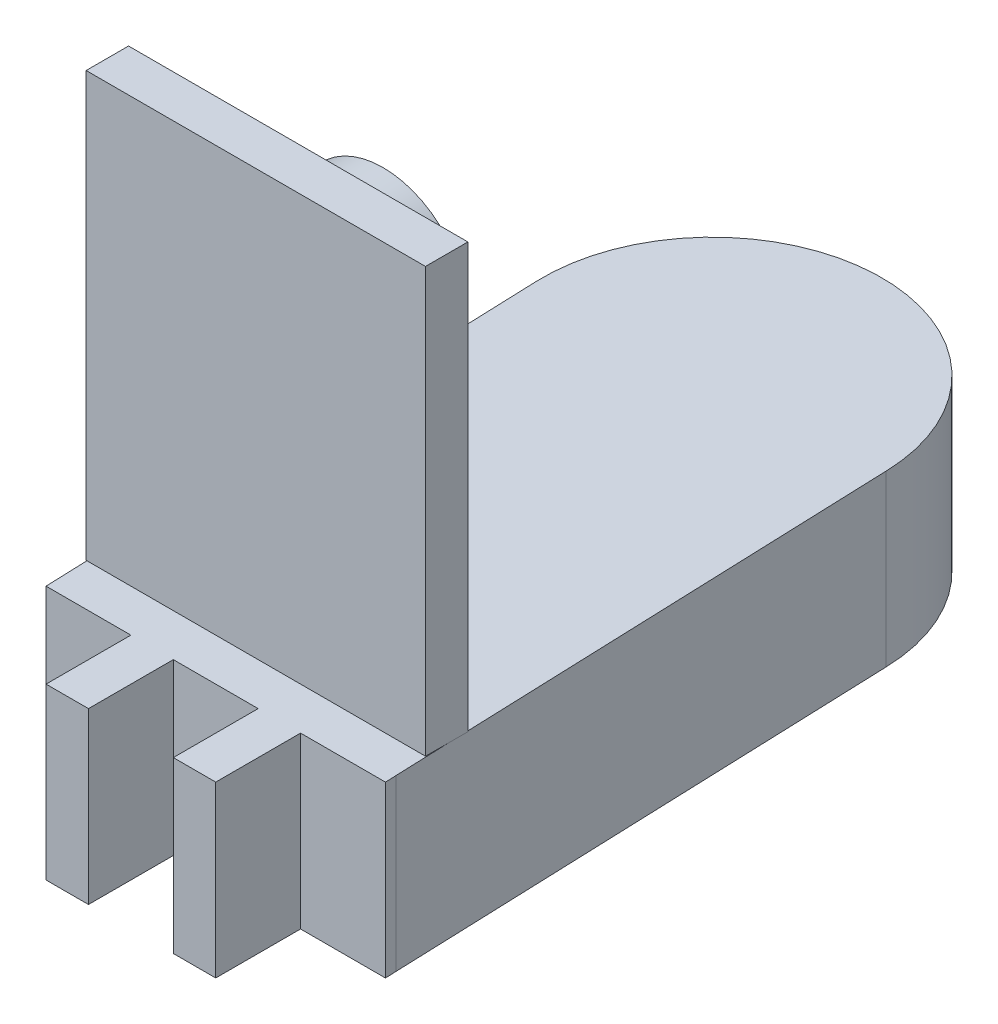
from build123d import *

# Parameters (mm, degrees)
BOSS_EXTRUDE1_DEPTH = 20
SKETCH2_W           = 40
SKETCH2_H           = 5
BOSS_EXTRUDE2_DEPTH = 50
SKETCH3_R           = 10
BOSS_EXTRUDE3_DEPTH = 10


with BuildPart() as part:
    # Sketch1 → Boss-Extrude1 (new body)
    with BuildSketch(Plane(origin=(0, 0, 0), x_dir=(1, 0, 0), z_dir=(0, 1, 0))):
        with BuildLine():
            Line((22.186265925, -59.437832279), (19.9931848, 0.522074285))
            ThreePointArc((19.9931848, 0.522074285), (-0.630541833, 19.990057954), (-19.986342651, -0.738990821))
            Line((-19.986342651, -0.738990821), (-17.767855256, -60.738990821))
            Line((-17.767855256, -60.738990821), (-7.767855256, -60.738990821))
            Line((-7.767855256, -60.738990821), (-7.767855256, -70.738990821))
            Line((-7.767855256, -70.738990821), (-2.767855256, -70.738990821))
            Line((-2.767855256, -70.738990821), (-2.767855256, -60.738990821))
            Line((-2.767855256, -60.738990821), (7.232144744, -60.738990821))
            Line((7.232144744, -60.738990821), (7.232144744, -70.738990821))
            Line((7.232144744, -70.738990821), (12.232144744, -70.738990821))
            Line((12.232144744, -70.738990821), (12.232144744, -60.738990821))
            Line((12.232144744, -60.738990821), (22.232144744, -60.738990821))
            ThreePointArc((22.232144744, -60.738990821), (22.220671476, -60.088007254), (22.186265925, -59.437832279))
        make_face()
    extrude(amount=BOSS_EXTRUDE1_DEPTH)

    # Sketch2 → Boss-Extrude2 (add)
    with BuildSketch(Plane(origin=(0, 20, 0), x_dir=(1, 0, 0), z_dir=(0, 1, 0))):
        with Locations((1.954821984, -53.238670729)):
            Rectangle(SKETCH2_W, SKETCH2_H)
    extrude(amount=BOSS_EXTRUDE2_DEPTH)

    # Sketch3 → Boss-Extrude3 (add)
    with BuildSketch(Plane(origin=(0, -50, 50.738670729), x_dir=(-1, 0, 0), z_dir=(0, 0, -1))):
        with Locations(Location((-1.954821984, 102.596055016, 0), (0, 0, 180))):
            Circle(SKETCH3_R)
    extrude(amount=BOSS_EXTRUDE3_DEPTH)


solid = part.part
